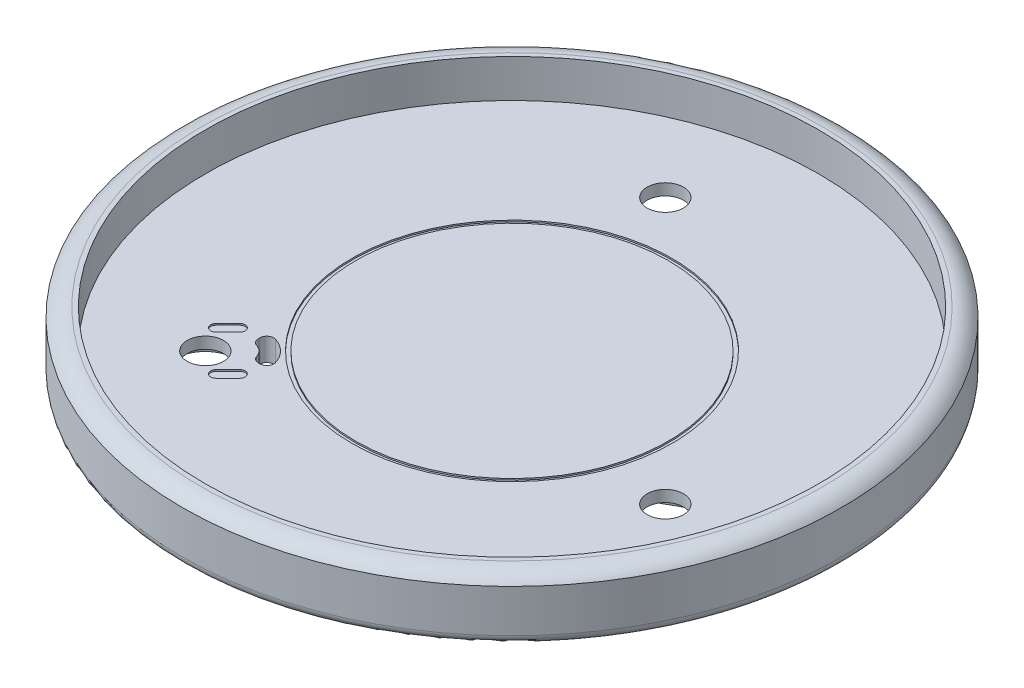
from build123d import *

# Parameters (mm, degrees)
SKETCH_1_R          = 40.2
EXTRUDE_1_DEPTH     = 3
SKETCH_3_R          = 43.2
SKETCH_3_R_2        = 40.2
EXTRUDE_2_DEPTH     = 8
SKETCH_4_R          = 21
SKETCH_4_R_2        = 20.5
CUT_EXTRUDE_1_DEPTH = 0.2
FILLET_2_R          = 1.2
CUT_EXTRUDE_2_DEPTH = 1.5
CUT_EXTRUDE_3_DEPTH = 10
CUT_EXTRUDE_4_DEPTH = 0.2
SKETCH_9_R          = 2.38
CUT_EXTRUDE_5_DEPTH = 10
CUT_EXTRUDE_6_DEPTH = 0.8


with BuildPart() as part:
    # 草图1 → 凸台-拉伸1 (new body)
    with BuildSketch(Plane(origin=(0, 0, 0), x_dir=(1, 0, 0), z_dir=(0, 1, 0))):
        with Locations(Location((0, 0, 0), (0, 0, 270))):
            Circle(SKETCH_1_R)
    extrude(amount=EXTRUDE_1_DEPTH)

    # 草图3 → 凸台-拉伸2 (add)
    with BuildSketch(Plane.XZ):
        with Locations(Location((0, 0, 0), (0, 0, 270))):
            Circle(SKETCH_3_R)
        with Locations(Location((0, 0, 0), (0, 0, 270))):
            Circle(SKETCH_3_R_2, mode=Mode.SUBTRACT)
    extrude(amount=-EXTRUDE_2_DEPTH)

    # 草图4 → 切除-拉伸1 (cut)
    with BuildSketch(Plane(origin=(0, 3, 0), x_dir=(1, 0, 0), z_dir=(0, 1, 0))):
        with Locations(Location((0, 0, 0), (0, 0, 270))):
            Circle(SKETCH_4_R)
        with Locations(Location((0, 0, 0), (0, 0, 270))):
            Circle(SKETCH_4_R_2, mode=Mode.SUBTRACT)
    extrude(amount=-CUT_EXTRUDE_1_DEPTH, mode=Mode.SUBTRACT)

    # 草图5 → 切除-旋转1 (revolve, cut)
    with BuildSketch(Plane(origin=(0, 0, 0), x_dir=(0, 0, -1), z_dir=(1, 0, 0))):
        with BuildLine():
            Line((43.2, 6.8), (43.2, 8))
            Line((43.2, 8), (40.8, 8))
            ThreePointArc((40.8, 8), (42.141640786, 7.683281573), (43.2, 6.8))
        make_face()
    revolve(axis=Axis((0, 0, 0), (0, 1, 0)), mode=Mode.SUBTRACT)

    # 圆角2
    fillet_2_edges = [part.edges().sort_by_distance(p)[0] for p in [
        (0, 0, 43.2),
    ]]
    fillet(fillet_2_edges, radius=FILLET_2_R)

    # 草图6 → 切除-拉伸2 (cut)
    with BuildSketch(Plane.XZ):
        with BuildLine():
            Line((-7.784609691, -34.516660498), (-7.091789368, -34.116660498))
            Line((-7.091789368, -34.116660498), (-3.986078552, -29.842016281))
            ThreePointArc((-3.986078552, -29.842016281), (-3.22762839, -27.700219097), (-3.758044914, -25.490875272))
            Line((-3.758044914, -25.490875272), (-4.856406461, -23.588457268))
            ThreePointArc((-4.856406461, -23.588457268), (-6.070819178, -22.656605616), (-7.588457268, -22.856406461))
            Line((-7.588457268, -22.856406461), (-9.490875272, -23.954768007))
            ThreePointArc((-9.490875272, -23.954768007), (-11.054901368, -25.602907623), (-11.468962853, -27.836983475))
            Line((-11.468962853, -27.836983475), (-10.916660498, -33.091789368))
            Line((-10.916660498, -33.091789368), (-10.516660498, -33.784609691))
            ThreePointArc((-10.516660498, -33.784609691), (-9.302247781, -34.716461343), (-7.784609691, -34.516660498))
        make_face()
        with BuildLine():
            Line((33.784609691, 10.516660498), (33.091789368, 10.916660498))
            Line((33.091789368, 10.916660498), (27.836983475, 11.468962853))
            ThreePointArc((27.836983475, 11.468962853), (25.602907623, 11.054901368), (23.954768007, 9.490875272))
            Line((23.954768007, 9.490875272), (22.856406461, 7.588457268))
            ThreePointArc((22.856406461, 7.588457268), (22.656605616, 6.070819178), (23.588457268, 4.856406461))
            Line((23.588457268, 4.856406461), (25.490875272, 3.758044914))
            ThreePointArc((25.490875272, 3.758044914), (27.700219097, 3.22762839), (29.842016281, 3.986078552))
            Line((29.842016281, 3.986078552), (34.116660498, 7.091789368))
            Line((34.116660498, 7.091789368), (34.516660498, 7.784609691))
            ThreePointArc((34.516660498, 7.784609691), (34.716461343, 9.302247781), (33.784609691, 10.516660498))
        make_face()
        with BuildLine():
            Line((-26, 24), (-26, 23.2))
            Line((-26, 23.2), (-23.850904924, 18.373053428))
            ThreePointArc((-23.850904924, 18.373053428), (-22.375279233, 16.645317728), (-20.196723093, 16))
            Line((-20.196723093, 16), (-18, 16))
            ThreePointArc((-18, 16), (-16.585786438, 16.585786438), (-16, 18))
            Line((-16, 18), (-16, 20.196723093))
            ThreePointArc((-16, 20.196723093), (-16.645317728, 22.375279233), (-18.373053428, 23.850904924))
            Line((-18.373053428, 23.850904924), (-23.2, 26))
            Line((-23.2, 26), (-24, 26))
            ThreePointArc((-24, 26), (-25.414213562, 25.414213562), (-26, 24))
        make_face()
    extrude(amount=-CUT_EXTRUDE_2_DEPTH, mode=Mode.SUBTRACT)

    # 草图7 → 切除-拉伸3 (cut)
    with BuildSketch(Plane.XZ):
        with BuildLine():
            Line((-18, 15.033520605), (-18, 15.24319025))
            ThreePointArc((-18, 15.24319025), (-17.828484492, 15.771688447), (-17.379310345, 16.098751896))
            ThreePointArc((-17.379310345, 16.098751896), (-16.585786438, 16.585786438), (-16.098751896, 17.379310345))
            ThreePointArc((-16.098751896, 17.379310345), (-15.771688447, 17.828484492), (-15.24319025, 18))
            Line((-15.24319025, 18), (-15.033520605, 18))
            ThreePointArc((-15.033520605, 18), (-14.310623209, 17.636115057), (-14.172284652, 16.838709677))
            ThreePointArc((-14.172284652, 16.838709677), (-15.171572875, 15.171572875), (-16.838709677, 14.172284652))
            ThreePointArc((-16.838709677, 14.172284652), (-17.636115057, 14.310623209), (-18, 15.033520605))
        make_face()
    extrude(amount=-CUT_EXTRUDE_3_DEPTH, mode=Mode.SUBTRACT)

    # 草图8 → 切除-拉伸4 (cut)
    with BuildSketch(Plane(origin=(0, 3, 0), x_dir=(1, 0, 0), z_dir=(0, 1, 0))):
        with BuildLine():
            ThreePointArc((-20.952735217, -14.730195543), (-19.962785724, -14.730195543), (-19.962785724, -15.720145037))
            Line((-19.962785724, -15.720145037), (-21.518420642, -17.275779955))
            ThreePointArc((-21.518420642, -17.275779955), (-22.508370136, -17.275779955), (-22.508370136, -16.285830462))
            Line((-22.508370136, -16.285830462), (-20.952735217, -14.730195543))
        make_face()
        with BuildLine():
            Line((-16.285830462, -22.508370136), (-14.730195543, -20.952735217))
            ThreePointArc((-14.730195543, -20.952735217), (-14.730195543, -19.962785724), (-15.720145037, -19.962785724))
            Line((-15.720145037, -19.962785724), (-17.275779955, -21.518420642))
            ThreePointArc((-17.275779955, -21.518420642), (-17.275779955, -22.508370136), (-16.285830462, -22.508370136))
        make_face()
    extrude(amount=-CUT_EXTRUDE_4_DEPTH, mode=Mode.SUBTRACT)

    # 草图9 → 切除-拉伸5 (cut)
    with BuildSketch(Plane(origin=(0, 3, 0), x_dir=(1, 0, 0), z_dir=(0, 1, 0))):
        with Locations(Location((-20.098361546, -20.098361546, 0), (0, 0, 270))):
            Circle(SKETCH_9_R)
        with Locations(Location((-7.3565109, 27.454872447, 0), (0, 0, 270))):
            Circle(SKETCH_9_R)
        with Locations(Location((27.454872447, -7.3565109, 0), (0, 0, 270))):
            Circle(SKETCH_9_R)
    extrude(amount=-CUT_EXTRUDE_5_DEPTH, mode=Mode.SUBTRACT)

    # 草图10 → 切除-拉伸6 (cut)
    # profile 1 of 3: a face of its own
    with BuildSketch(Plane.XZ):
        with BuildLine():
            add(Edge.make_bspline(
                [(-10.079356338, 4.867216538), (-10.179952666, 4.772388159), (-10.375534584, 4.588020433), (-10.693851774, 4.355659746), (-11.022996283, 4.174329259), (-11.360096894, 4.043494065), (-11.700654105, 3.960920857), (-12.041832646, 3.931370423), (-12.381629428, 3.948645726), (-12.718459147, 4.016200632), (-13.049190472, 4.132553617), (-13.367421854, 4.301450609), (-13.677446691, 4.514293305), (-13.863268286, 4.690466362), (-13.958848525, 4.781083725)],
                knots=[0, 0, 0, 0, 1.136115981, 2.208865351, 3.231062099, 4.218092323, 5.174148399, 6.102954762, 7.024583534, 7.962990089, 8.918560302, 9.897073085, 10.918326705, 12, 12, 12, 12], degree=3))
            Line((-13.958848525, 4.781083725), (-16.69048915, 7.51272435))
            add(Edge.make_bspline(
                [(-16.69048915, 7.51272435), (-16.781106513, 7.608304589), (-16.957279571, 7.794126185), (-17.170122266, 8.104151021), (-17.339019259, 8.422382404), (-17.455372243, 8.753113729), (-17.52292715, 9.089943447), (-17.540202452, 9.429740229), (-17.510652018, 9.770918771), (-17.42807881, 10.111475981), (-17.297243616, 10.448576593), (-17.115913129, 10.777721101), (-16.883552443, 11.096038291), (-16.699184716, 11.29162021), (-16.604356338, 11.392216538)],
                knots=[0, 0, 0, 0, 1.081673295, 2.102926915, 3.081439698, 4.037009911, 4.975416466, 5.897045238, 6.825851601, 7.781907677, 8.768937901, 9.791134649, 10.863884019, 12, 12, 12, 12], degree=3))
            add(Edge.make_bspline(
                [(-16.604356338, 11.392216538), (-16.503304185, 11.487801528), (-16.307654295, 11.672866291), (-15.987547331, 11.903617984), (-15.659428783, 12.084731391), (-15.323155572, 12.216270207), (-14.983035171, 12.298474225), (-14.641903529, 12.328022795), (-14.302012057, 12.310984095), (-13.965168422, 12.242391738), (-13.632812434, 12.129583479), (-13.314609234, 11.95952146), (-13.004487435, 11.746957112), (-12.818679533, 11.570744745), (-12.723106338, 11.480107163)],
                knots=[0, 0, 0, 0, 1.142688929, 2.212391883, 3.234380344, 4.216718667, 5.172579933, 6.101197039, 7.022638017, 7.960853358, 8.919188188, 9.897501586, 10.918547111, 12, 12, 12, 12], degree=3))
            Line((-12.723106338, 11.480107163), (-9.991465713, 8.748466538))
            add(Edge.make_bspline(
                [(-9.991465713, 8.748466538), (-9.90082813, 8.652893342), (-9.724615764, 8.46708544), (-9.512051415, 8.156963641), (-9.341989396, 7.838760441), (-9.229181137, 7.506404453), (-9.160588781, 7.169560818), (-9.14355008, 6.829669346), (-9.17309865, 6.488537705), (-9.255302668, 6.148417303), (-9.386841484, 5.812144092), (-9.567954891, 5.484025544), (-9.798706584, 5.16391858), (-9.983771348, 4.968268691), (-10.079356338, 4.867216538)],
                knots=[0, 0, 0, 0, 1.081452889, 2.102498414, 3.080811812, 4.039146642, 4.977361983, 5.898802961, 6.827420067, 7.783281333, 8.765619656, 9.787608117, 10.857311071, 12, 12, 12, 12], degree=3))
        make_face()
        with BuildLine():
            add(Edge.make_bspline(
                [(-11.019786025, 5.807646225), (-10.98473469, 5.844703326), (-10.916164343, 5.91719752), (-10.823640946, 6.031046135), (-10.747945889, 6.15033688), (-10.684794341, 6.270784792), (-10.634164269, 6.393512619), (-10.599669779, 6.519368035), (-10.575473476, 6.647498251), (-10.569865043, 6.777952375), (-10.57432649, 6.908088154), (-10.593614457, 7.036732155), (-10.627875016, 7.161815293), (-10.672815734, 7.284746603), (-10.736292742, 7.402336876), (-10.809586417, 7.519055721), (-10.898468045, 7.632248484), (-10.965861347, 7.703112251), (-11.000450088, 7.739482163)],
                knots=[0, 0, 0, 0, 1.123174975, 2.197248608, 3.224495634, 4.228712617, 5.189549244, 6.14133267, 7.098088556, 8.054322242, 9.009946336, 9.962516613, 10.910882808, 11.862316313, 12.837685189, 13.847111187, 14.895057655, 16, 16, 16, 16], degree=3))
            Line((-11.000450088, 7.739482163), (-13.732090713, 10.471122788))
            add(Edge.make_bspline(
                [(-13.732090713, 10.471122788), (-13.768406192, 10.505799239), (-13.839163901, 10.573363437), (-13.952974526, 10.66092342), (-14.066614635, 10.738339199), (-14.186055372, 10.797871855), (-14.307797815, 10.845547196), (-14.432294648, 10.881800654), (-14.56002391, 10.900028173), (-14.68889703, 10.907785679), (-14.818035153, 10.900700943), (-14.945958652, 10.879433721), (-15.071374739, 10.843783333), (-15.195612662, 10.794665061), (-15.316219789, 10.728189825), (-15.437079192, 10.651543534), (-15.55260447, 10.55712933), (-15.626278359, 10.487412854), (-15.66392665, 10.45178685)],
                knots=[0, 0, 0, 0, 1.102832843, 2.148778623, 3.152483981, 4.120095036, 5.074329331, 6.024295658, 6.962314458, 7.903862974, 8.858271066, 9.798321073, 10.7482874, 11.719235203, 12.727556838, 13.770644404, 14.860771026, 16, 16, 16, 16], degree=3))
            add(Edge.make_bspline(
                [(-15.66392665, 10.45178685), (-15.69957054, 10.414147507), (-15.769322019, 10.340491129), (-15.863485966, 10.224840658), (-15.940876674, 10.104658818), (-16.004199159, 9.982535906), (-16.056517891, 9.859727394), (-16.091388124, 9.73374831), (-16.112942734, 9.605904763), (-16.119702741, 9.476791598), (-16.112938444, 9.34764753), (-16.091139335, 9.221227996), (-16.058532719, 9.096165826), (-16.007608422, 8.976137522), (-15.948928807, 8.85615729), (-15.871246645, 8.742613867), (-15.783761317, 8.628776146), (-15.716186616, 8.558022248), (-15.681504775, 8.521708725)],
                knots=[0, 0, 0, 0, 1.139956555, 2.230779399, 3.274533144, 4.277473055, 5.253900326, 6.204473361, 7.14512374, 8.100141376, 9.042291223, 9.982941603, 10.917658897, 11.877273619, 12.84550265, 13.849849036, 14.896462821, 16, 16, 16, 16], degree=3))
            Line((-15.681504775, 8.521708725), (-12.94986415, 5.7900681))
            add(Edge.make_bspline(
                [(-12.94986415, 5.7900681), (-12.913494298, 5.755478979), (-12.842630649, 5.688084935), (-12.72943705, 5.599208589), (-12.6127212, 5.525895982), (-12.495120272, 5.462486353), (-12.372227476, 5.417302077), (-12.24747227, 5.384069929), (-12.119859838, 5.361420025), (-11.990057725, 5.357922092), (-11.859656032, 5.363301311), (-11.731470465, 5.387462437), (-11.605259501, 5.422471555), (-11.481902104, 5.471721392), (-11.362198976, 5.536405282), (-11.243140221, 5.611410082), (-11.129349581, 5.704048969), (-11.056847274, 5.772603152), (-11.019786025, 5.807646225)],
                knots=[0, 0, 0, 0, 1.105645508, 2.154258869, 3.164327246, 4.140316827, 5.092355806, 6.041325522, 6.983773033, 7.940005267, 8.896847481, 9.854212228, 10.80660135, 11.780025458, 12.773452361, 13.801353106, 14.876110259, 16, 16, 16, 16], degree=3))
        make_face(mode=Mode.SUBTRACT)
    # profile 2 of 3: a face of its own
    with BuildSketch(Plane.XZ):
        with BuildLine():
            add(Edge.make_bspline(
                [(-12.779356338, 7.567216538), (-12.821974949, 7.527992427), (-12.903736257, 7.45274327), (-13.043998221, 7.370961913), (-13.188922028, 7.316975696), (-13.340065898, 7.299784972), (-13.491929993, 7.315862892), (-13.640922547, 7.366441163), (-13.784790754, 7.454074096), (-13.869960047, 7.53273765), (-13.914903213, 7.574247788)],
                knots=[0, 0, 0, 0, 1.078468522, 2.068978668, 3.010058665, 3.94623103, 4.881188457, 5.839340878, 6.859837199, 8, 8, 8, 8], degree=3))
            add(Edge.make_bspline(
                [(-13.914903213, 7.574247788), (-13.955951752, 7.618541183), (-14.03404063, 7.702802926), (-14.11828669, 7.845829791), (-14.168472451, 7.991815823), (-14.18120286, 8.140995248), (-14.156713285, 8.28832961), (-14.102603835, 8.431371538), (-14.01847208, 8.569153861), (-13.943409568, 8.650101445), (-13.904356338, 8.692216538)],
                knots=[0, 0, 0, 0, 1.139675049, 2.168066075, 3.114402787, 4.037609751, 4.968766405, 5.91575196, 6.91561558, 8, 8, 8, 8], degree=3))
            add(Edge.make_bspline(
                [(-13.904356338, 8.692216538), (-13.862243556, 8.731290315), (-13.781300413, 8.806392321), (-13.6434873, 8.89025032), (-13.501180568, 8.945082922), (-13.354221392, 8.966191813), (-13.205149316, 8.956846702), (-13.0584074, 8.906369193), (-12.91495589, 8.821918905), (-12.830685518, 8.74381818), (-12.786387588, 8.702763413)],
                knots=[0, 0, 0, 0, 1.084786176, 2.085020238, 3.032356643, 3.951234827, 4.873918182, 5.831130674, 6.85990271, 8, 8, 8, 8], degree=3))
            add(Edge.make_bspline(
                [(-12.786387588, 8.702763413), (-12.744877361, 8.657817276), (-12.666213638, 8.572642351), (-12.578290451, 8.428333959), (-12.527711566, 8.27865688), (-12.51405244, 8.126586462), (-12.531479619, 7.976632831), (-12.582621019, 7.831469363), (-12.665046618, 7.691658532), (-12.740188267, 7.609856419), (-12.779356338, 7.567216538)],
                knots=[0, 0, 0, 0, 1.140905902, 2.162067331, 3.131221777, 4.065699465, 4.991612349, 5.929672876, 6.920828586, 8, 8, 8, 8], degree=3))
        make_face()
    # profile 3 of 3: a face of its own
    with BuildSketch(Plane.XZ):
        with BuildLine():
            add(Edge.make_bspline(
                [(-4.908638, 10.037934875), (-5.012688134, 9.939527562), (-5.215491811, 9.747722283), (-5.546615738, 9.504954511), (-5.890094242, 9.312129355), (-6.241448335, 9.164987041), (-6.59725685, 9.0680232), (-6.951927636, 9.01846893), (-7.302943452, 9.022844846), (-7.590266739, 9.06561539), (-7.814920725, 9.122670648), (-7.978808077, 9.182956643), (-8.140905497, 9.249034849), (-8.29571926, 9.33465046), (-8.449729657, 9.426059168), (-8.597020194, 9.534931974), (-8.741933887, 9.654109278), (-8.833228105, 9.741990548), (-8.879536438, 9.786567688)],
                knots=[0, 0, 0, 0, 1.538029354, 2.997766531, 4.39900187, 5.762546649, 7.080848009, 8.351673136, 9.598543389, 10.839963688, 11.464637839, 12.086034341, 12.715262217, 13.343481006, 13.984972279, 14.638678865, 15.309479682, 16, 16, 16, 16], degree=3))
            add(Edge.make_bspline(
                [(-8.879536438, 9.786567688), (-8.926009805, 9.835102576), (-9.017184422, 9.930321624), (-9.139244612, 10.083289168), (-9.24766716, 10.241202558), (-9.337377866, 10.407478901), (-9.419224865, 10.576052692), (-9.479362078, 10.753080287), (-9.527280074, 10.934547485), (-9.560568023, 11.120261217), (-9.57862147, 11.307242892), (-9.578242642, 11.492586845), (-9.562524572, 11.674326579), (-9.531123639, 11.852115306), (-9.482646958, 12.025997711), (-9.420167884, 12.196679412), (-9.338081018, 12.363172895), (-9.272965403, 12.469479942), (-9.239888, 12.52348175)],
                knots=[0, 0, 0, 0, 1.076688391, 2.112320617, 3.133540958, 4.142550451, 5.138402501, 6.13354557, 7.133685057, 8.145183402, 9.15458628, 10.140824086, 11.111962651, 12.075577314, 13.030362259, 14.002181926, 14.985149214, 16, 16, 16, 16], degree=3))
            Line((-9.239888, 12.52348175), (-9.257466125, 12.541059875))
            add(Edge.make_bspline(
                [(-9.257466125, 12.541059875), (-9.303179358, 12.512465146), (-9.393385852, 12.456038809), (-9.537665148, 12.390407329), (-9.683206014, 12.334354261), (-9.833778853, 12.296227689), (-9.987301684, 12.271374114), (-10.14384236, 12.260944618), (-10.303809958, 12.264734598), (-10.465547076, 12.282125455), (-10.627359081, 12.313619668), (-10.785337687, 12.359612971), (-10.938820195, 12.417671885), (-11.088108526, 12.488893906), (-11.233213203, 12.573040819), (-11.374754694, 12.669958672), (-11.510337762, 12.781434487), (-11.595876178, 12.863343661), (-11.639302063, 12.904927063)],
                knots=[0, 0, 0, 0, 0.98894153, 1.95149071, 2.904675468, 3.849260987, 4.797271144, 5.756930142, 6.725413086, 7.731699174, 8.740225606, 9.748063231, 10.749102355, 11.750025851, 12.78152979, 13.825968452, 14.896294231, 16, 16, 16, 16], degree=3))
            add(Edge.make_bspline(
                [(-11.639302063, 12.904927063), (-11.718978891, 12.990875296), (-11.874748463, 13.158905574), (-12.064925203, 13.439417662), (-12.207035891, 13.735848784), (-12.302552813, 14.045207617), (-12.35137606, 14.363800525), (-12.35728091, 14.686840065), (-12.315350145, 15.013301392), (-12.228233502, 15.339639637), (-12.099104413, 15.663981807), (-11.919356292, 15.976785609), (-11.699666291, 16.281667982), (-11.52380633, 16.467601533), (-11.433638, 16.562934875)],
                knots=[0, 0, 0, 0, 1.025149777, 2.004185478, 2.954238203, 3.893871291, 4.82849042, 5.767521004, 6.713811954, 7.700667424, 8.718188266, 9.76122054, 10.852115031, 12, 12, 12, 12], degree=3))
            add(Edge.make_bspline(
                [(-11.433638, 16.562934875), (-11.338253283, 16.653026413), (-11.151623967, 16.829299118), (-10.846274451, 17.050718676), (-10.530691713, 17.229829576), (-10.205171386, 17.36091966), (-9.876635201, 17.450712631), (-9.548719997, 17.490923134), (-9.224557403, 17.488226217), (-8.905931834, 17.438893871), (-8.595922324, 17.343519875), (-8.300196127, 17.200920788), (-8.018678519, 17.01354202), (-7.852042053, 16.857282972), (-7.766841125, 16.777388)],
                knots=[0, 0, 0, 0, 1.145219595, 2.240731605, 3.285801634, 4.307622725, 5.298447256, 6.252699298, 7.184361139, 8.121868308, 9.05931958, 10.007166295, 10.981067682, 12, 12, 12, 12], degree=3))
            add(Edge.make_bspline(
                [(-7.766841125, 16.777388), (-7.725159314, 16.734042027), (-7.642741036, 16.648333167), (-7.532432721, 16.51121171), (-7.434894351, 16.369593409), (-7.350490281, 16.22400934), (-7.279258842, 16.073697805), (-7.223594236, 15.918536822), (-7.179111963, 15.759383052), (-7.147822223, 15.597170538), (-7.129448906, 15.434306406), (-7.128694139, 15.273686941), (-7.138602768, 15.116664745), (-7.162697211, 14.962693262), (-7.20450257, 14.813281538), (-7.256442533, 14.665997607), (-7.325757655, 14.52367107), (-7.380597892, 14.432652808), (-7.408247375, 14.386763)],
                knots=[0, 0, 0, 0, 1.100897107, 2.176825875, 3.218606696, 4.247485709, 5.255561152, 6.26037578, 7.262723476, 8.279216757, 9.282942092, 10.259511896, 11.216728796, 12.162326498, 13.107254191, 14.054312089, 15.019018359, 16, 16, 16, 16], degree=3))
            Line((-7.408247375, 14.386763), (-7.39066925, 14.369184875))
            add(Edge.make_bspline(
                [(-7.39066925, 14.369184875), (-7.337289015, 14.402321591), (-7.231790979, 14.467811344), (-7.065591941, 14.549413191), (-6.894951309, 14.611944358), (-6.721059433, 14.66046789), (-6.543843987, 14.69152755), (-6.362712705, 14.708191976), (-6.177922653, 14.70565694), (-5.990594738, 14.687563351), (-5.803915937, 14.657141714), (-5.621559985, 14.609230247), (-5.445498082, 14.545371619), (-5.274833085, 14.468207643), (-5.109919674, 14.3762389), (-4.952031844, 14.268114091), (-4.797624225, 14.147055863), (-4.702217351, 14.055393462), (-4.653755188, 14.008833313)],
                knots=[0, 0, 0, 0, 1.006957806, 1.990101223, 2.962095021, 3.917051045, 4.880838369, 5.842792526, 6.829251781, 7.838835525, 8.858162999, 9.858481691, 10.856945896, 11.857573336, 12.858553513, 13.879956836, 14.923118687, 16, 16, 16, 16], degree=3))
            add(Edge.make_bspline(
                [(-4.653755188, 14.008833313), (-4.608981794, 13.963282504), (-4.520684405, 13.873451978), (-4.404048157, 13.727435115), (-4.294999541, 13.58082551), (-4.202979136, 13.426489951), (-4.119133637, 13.270849223), (-4.050505592, 13.109426108), (-3.994310699, 12.94426539), (-3.935832619, 12.719737052), (-3.89371343, 12.432181267), (-3.889126746, 12.081240683), (-3.938739058, 11.72654918), (-4.035686573, 11.370746492), (-4.182833485, 11.019390759), (-4.375657353, 10.675912714), (-4.618425485, 10.344788659), (-4.810230713, 10.141985), (-4.908638, 10.037934875)],
                knots=[0, 0, 0, 0, 0.686151504, 1.353155997, 2.007064206, 2.648753334, 3.282728973, 3.906356386, 4.531826128, 5.156692947, 6.398496137, 7.645750962, 8.916968048, 10.235676012, 11.599641348, 13.001308869, 14.461496272, 16, 16, 16, 16], degree=3))
        make_face()
        with BuildLine():
            add(Edge.make_bspline(
                [(-8.733638, 13.862934875), (-8.672349287, 13.929995657), (-8.554243984, 14.059223919), (-8.425603396, 14.281795227), (-8.344816829, 14.515106425), (-8.319580186, 14.756998365), (-8.342264499, 14.997362009), (-8.413387535, 15.229293191), (-8.538189614, 15.446433307), (-8.651972166, 15.5717773), (-8.710786438, 15.636567688)],
                knots=[0, 0, 0, 0, 1.092009799, 2.104337669, 3.073293497, 4.046304733, 5.010852268, 5.964381387, 6.947787466, 8, 8, 8, 8], degree=3))
            add(Edge.make_bspline(
                [(-8.710786438, 15.636567688), (-8.776634965, 15.696770048), (-8.903852068, 15.81307895), (-9.124616784, 15.937640021), (-9.35683882, 16.015237368), (-9.598672878, 16.036202715), (-9.841006673, 16.011438572), (-10.074356352, 15.930508501), (-10.296916936, 15.801907903), (-10.426146734, 15.683796873), (-10.493208313, 15.622505188)],
                knots=[0, 0, 0, 0, 1.065852488, 2.059190569, 3.011406324, 3.977311533, 4.944643786, 5.907944302, 6.914363719, 8, 8, 8, 8], degree=3))
            add(Edge.make_bspline(
                [(-10.493208313, 15.622505188), (-10.554470741, 15.556056589), (-10.672806393, 15.427703236), (-10.802296633, 15.205316963), (-10.878950035, 14.970289727), (-10.9077496, 14.728174181), (-10.885720127, 14.486099329), (-10.808404241, 14.253923741), (-10.683765205, 14.033146159), (-10.567467419, 13.90593089), (-10.507270813, 13.840083313)],
                knots=[0, 0, 0, 0, 1.080306942, 2.086741077, 3.054494824, 4.022630303, 4.988549637, 5.940779317, 6.934131925, 8, 8, 8, 8], degree=3))
            add(Edge.make_bspline(
                [(-10.507270813, 13.840083313), (-10.442597853, 13.781044775), (-10.317694816, 13.667023513), (-10.09911176, 13.545258944), (-9.868526526, 13.471101585), (-9.627430454, 13.448228767), (-9.385841531, 13.477256009), (-9.15082954, 13.553829087), (-8.928439037, 13.683341614), (-8.800086286, 13.801674091), (-8.733638, 13.862934875)],
                knots=[0, 0, 0, 0, 1.052407368, 2.032516768, 2.98833759, 3.953063727, 4.927048978, 5.900650191, 6.913165511, 8, 8, 8, 8], degree=3))
        make_face(mode=Mode.SUBTRACT)
        with BuildLine():
            add(Edge.make_bspline(
                [(-5.849067688, 10.978364563), (-5.81150378, 11.017632244), (-5.738183326, 11.094278268), (-5.641079274, 11.216931571), (-5.555979493, 11.341480013), (-5.48522985, 11.470373517), (-5.429015889, 11.60235226), (-5.385992879, 11.737046899), (-5.35855684, 11.874503235), (-5.342270352, 12.013237944), (-5.33997581, 12.151774873), (-5.354339661, 12.28734526), (-5.382759852, 12.41872347), (-5.424914755, 12.546425516), (-5.483342689, 12.66943739), (-5.556446582, 12.787960329), (-5.642690354, 12.903020674), (-5.709486467, 12.974097302), (-5.743598938, 13.010395813)],
                knots=[0, 0, 0, 0, 1.140396113, 2.225922843, 3.280259296, 4.304303262, 5.307443125, 6.287922736, 7.267475764, 8.245637271, 9.217590136, 10.169959598, 11.101359983, 12.035032476, 12.987084058, 13.953415041, 14.954818386, 16, 16, 16, 16], degree=3))
            add(Edge.make_bspline(
                [(-5.743598938, 13.010395813), (-5.780407707, 13.045756855), (-5.852230181, 13.114754476), (-5.969860747, 13.203239642), (-6.090456205, 13.277065718), (-6.215368224, 13.33616699), (-6.344511769, 13.380201554), (-6.477645556, 13.410395933), (-6.615136605, 13.424121866), (-6.754665097, 13.423958346), (-6.894949403, 13.41035048), (-7.032849459, 13.380981109), (-7.168747585, 13.342265829), (-7.299291233, 13.28359511), (-7.429127233, 13.215561239), (-7.554365343, 13.130909841), (-7.677266325, 13.03335915), (-7.75393105, 12.960058797), (-7.793208313, 12.922505188)],
                knots=[0, 0, 0, 0, 1.061770955, 2.071762182, 3.057071194, 4.001043719, 4.942253891, 5.892197007, 6.836484714, 7.812310262, 8.793002801, 9.764243395, 10.74448068, 11.727900315, 12.737449501, 13.792966216, 14.869281226, 16, 16, 16, 16], degree=3))
            add(Edge.make_bspline(
                [(-7.793208313, 12.922505188), (-7.830743498, 12.88321643), (-7.90400789, 12.806529268), (-8.001309765, 12.684425497), (-8.084654311, 12.559339265), (-8.15321334, 12.430037179), (-8.210269723, 12.298109804), (-8.252292965, 12.162519333), (-8.280879975, 12.024190894), (-8.294707978, 11.883976807), (-8.294813004, 11.744429656), (-8.281102247, 11.606943448), (-8.250903831, 11.473808374), (-8.206870341, 11.344665171), (-8.147768779, 11.21975306), (-8.073942784, 11.099157628), (-7.985457596, 10.981527054), (-7.916459978, 10.909704582), (-7.881098938, 10.872895813)],
                knots=[0, 0, 0, 0, 1.130870146, 2.207329244, 3.246075178, 4.255759514, 5.25051994, 6.234449445, 7.205820061, 8.186643887, 9.162600071, 10.107014192, 11.057084479, 11.998420653, 12.942519549, 13.927960467, 14.938086904, 16, 16, 16, 16], degree=3))
            add(Edge.make_bspline(
                [(-7.881098938, 10.872895813), (-7.844800427, 10.83878334), (-7.773723799, 10.771987223), (-7.658663454, 10.685743477), (-7.540140516, 10.612639491), (-7.41712864, 10.554211899), (-7.289426601, 10.512055748), (-7.158048362, 10.483640215), (-7.022478085, 10.469258485), (-6.883357271, 10.471631494), (-6.744052212, 10.4878123), (-6.605677524, 10.514863823), (-6.471996493, 10.560057426), (-6.341159182, 10.616967222), (-6.21165683, 10.684892998), (-6.087717259, 10.770527084), (-5.964959267, 10.867439753), (-5.888327873, 10.940786952), (-5.849067688, 10.978364563)],
                knots=[0, 0, 0, 0, 1.045257356, 2.046733273, 3.013134284, 3.96525486, 4.898995014, 5.830462897, 6.782901375, 7.754924677, 8.745382085, 9.725006099, 10.709331535, 11.701239716, 12.719502988, 13.773915848, 14.859521244, 16, 16, 16, 16], degree=3))
        make_face(mode=Mode.SUBTRACT)
    extrude(amount=-CUT_EXTRUDE_6_DEPTH, mode=Mode.SUBTRACT)


solid = part.part
